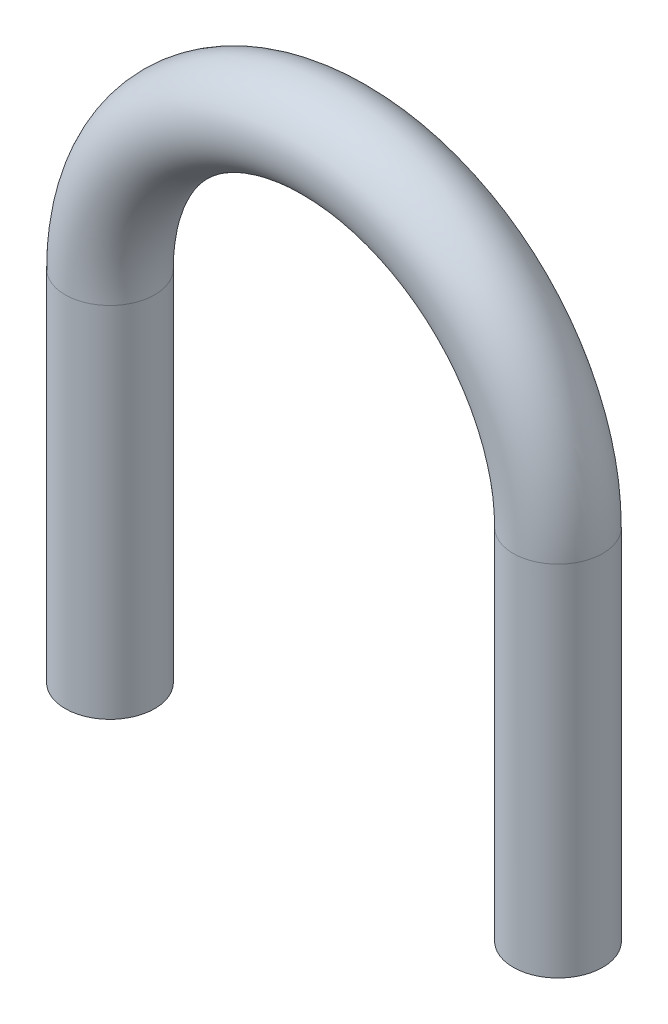
from build123d import *

# Parameters (mm, degrees)
SKETCH1_R = 2


with BuildPart() as part:
    # Sweep1: sweep along a path in Sketch2
    with BuildLine(Plane.XY) as sweep1_path:
        Line((-10, 0), (-10, 16))
        ThreePointArc((-10, 16), (0, 26), (10, 16))
        Line((10, 16), (10, 0))
    # Sketch1 → Sweep1 (sweep)
    with BuildSketch(Plane(origin=(0, 0, 0), x_dir=(1, 0, 0), z_dir=(0, 1, 0))):
        with Locations((-10, 0)):
            Circle(SKETCH1_R)
    sweep(path=sweep1_path.line)


solid = part.part
